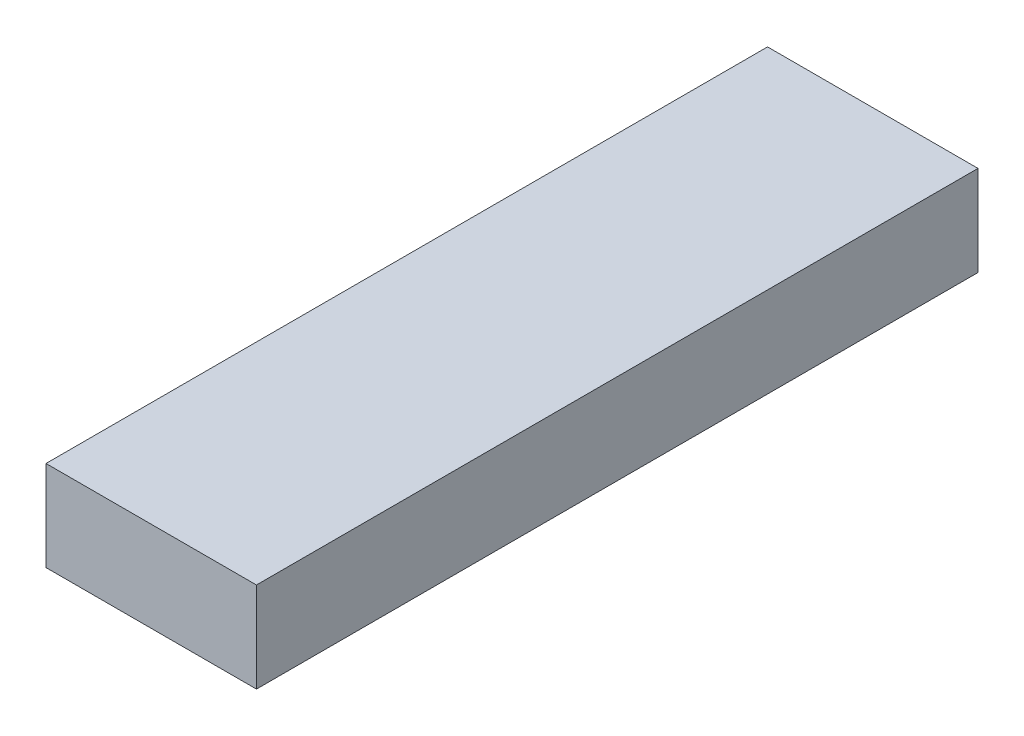
from build123d import *

# Parameters (mm, degrees)
SKETCH1_W           = 88.9
SKETCH1_H           = 38.1
BOSS_EXTRUDE1_DEPTH = 152.4


with BuildPart() as part:
    # Sketch1 → Boss-Extrude1 (new, symmetric)
    with BuildSketch(Plane.XY):
        Rectangle(SKETCH1_W, SKETCH1_H)
    extrude(amount=BOSS_EXTRUDE1_DEPTH, both=True)


solid = part.part
